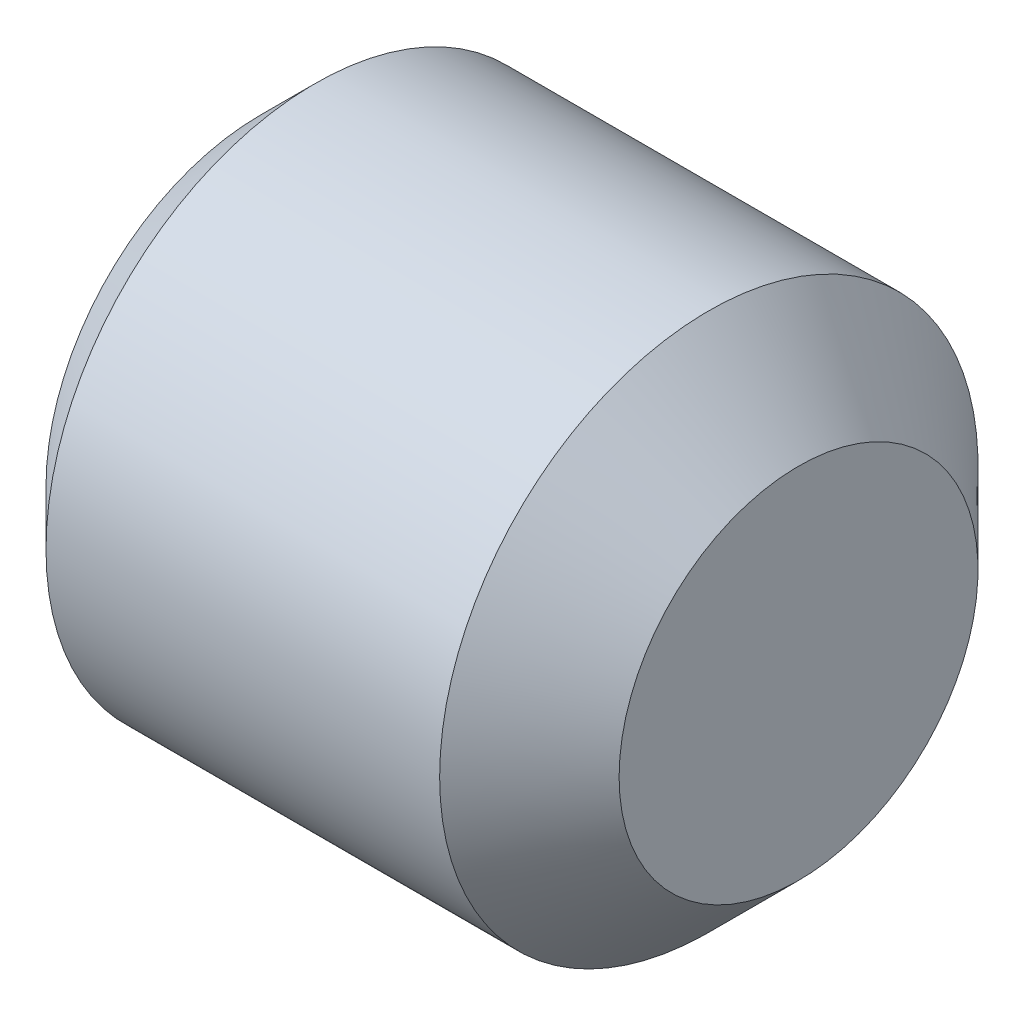
from build123d import *

# Parameters (mm, degrees)
CUT_EXTRUDE1_DEPTH = 1.2


with BuildPart() as part:
    # Sketch1 → Revolve1 (revolve)
    with BuildSketch(Plane.XY, mode=Mode.PRIVATE) as revolve1_sk:
        Polygon((-3, 0), (-3, 1.1935), (-2.6935, 1.5), (-0.5, 1.5), (0, 1), (0, 0), align=None)
    revolve(revolve1_sk.sketch.rotate(Axis((0, 0, 0), (-1, 0, 0)), 270), axis=Axis((0, 0, 0), (-1, 0, 0)))

    # Sketch2 → Cut-Extrude1 (cut)
    with BuildSketch(Plane.ZY.offset(3)):
        Polygon((-0.433012702, -0.75), (0.433012702, -0.75), (0.866025404, 0), (0.433012702, 0.75), (-0.433012702, 0.75), (-0.866025404, 0), align=None)
    extrude(amount=-CUT_EXTRUDE1_DEPTH, mode=Mode.SUBTRACT)

    # Sketch3 → Cut-Revolve1 (revolve, cut)
    with BuildSketch(Plane.XY, mode=Mode.PRIVATE) as cut_revolve1_sk:
        Polygon((-1.8, 0), (-1.8, 0.75), (-1.366987298, 0), align=None)
    revolve(cut_revolve1_sk.sketch.rotate(Axis((-1.366987298, 0, 0), (-1, 0, 0)), 270), axis=Axis((-1.366987298, 0, 0), (-1, 0, 0)), mode=Mode.SUBTRACT)


solid = part.part
